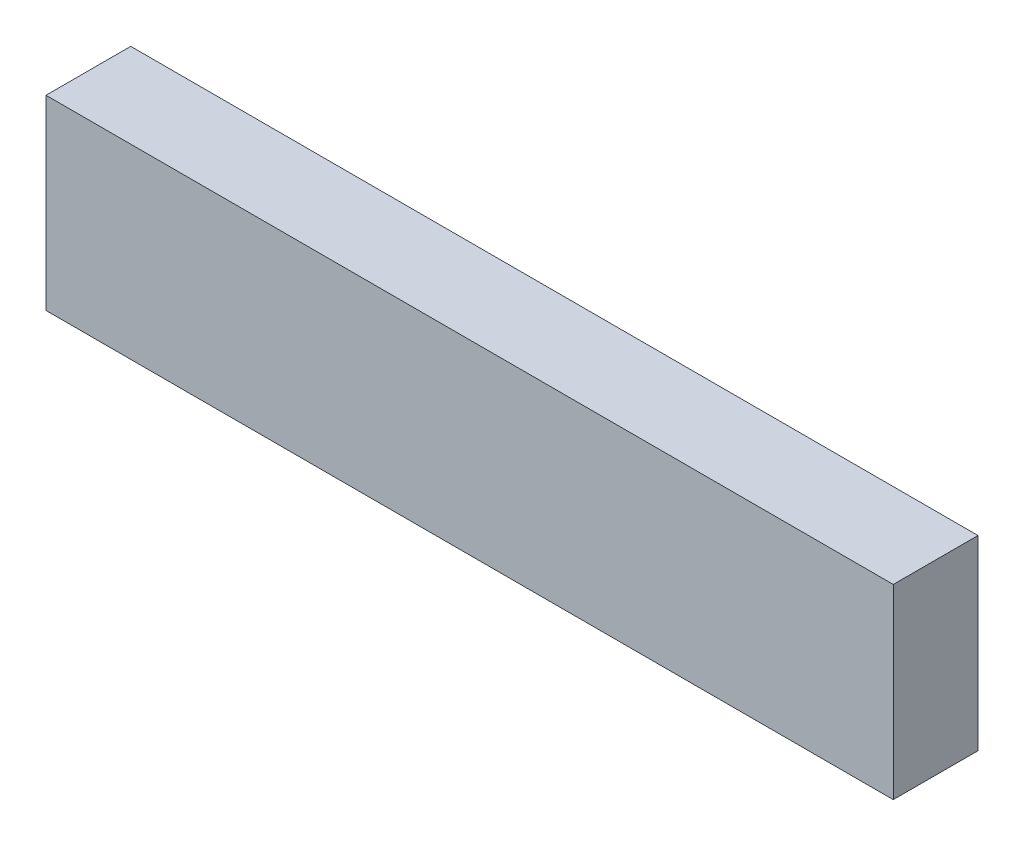
from build123d import *

# Parameters (mm, degrees)
EDRAWING1_W    = 50
EDRAWING1_H    = 11
EXTRUDE1_DEPTH = 5


with BuildPart() as part:
    # edrawing1 → extrude1 (new body)
    with BuildSketch(Plane.XY):
        with Locations((-25, 5.5)):
            Rectangle(EDRAWING1_W, EDRAWING1_H)
    extrude(amount=EXTRUDE1_DEPTH)


solid = part.part
